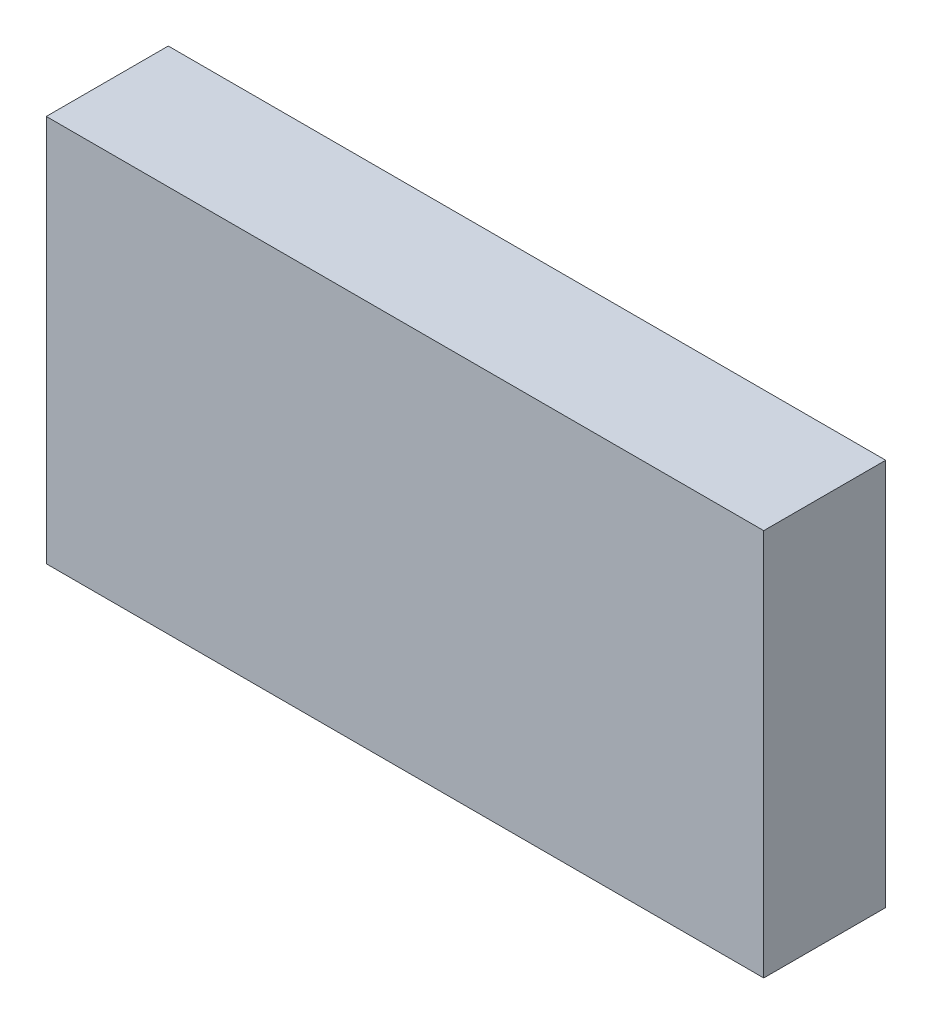
from build123d import *

# Parameters (mm, degrees)
SKETCH_1_W      = 100
SKETCH_1_H      = 54
EXTRUDE_1_DEPTH = 17


with BuildPart() as part:
    # 草图1 → 凸台-拉伸1 (new body)
    with BuildSketch(Plane.XY):
        with Locations((2.843367755, 16.518507486)):
            Rectangle(SKETCH_1_W, SKETCH_1_H)
    extrude(amount=EXTRUDE_1_DEPTH)


solid = part.part
